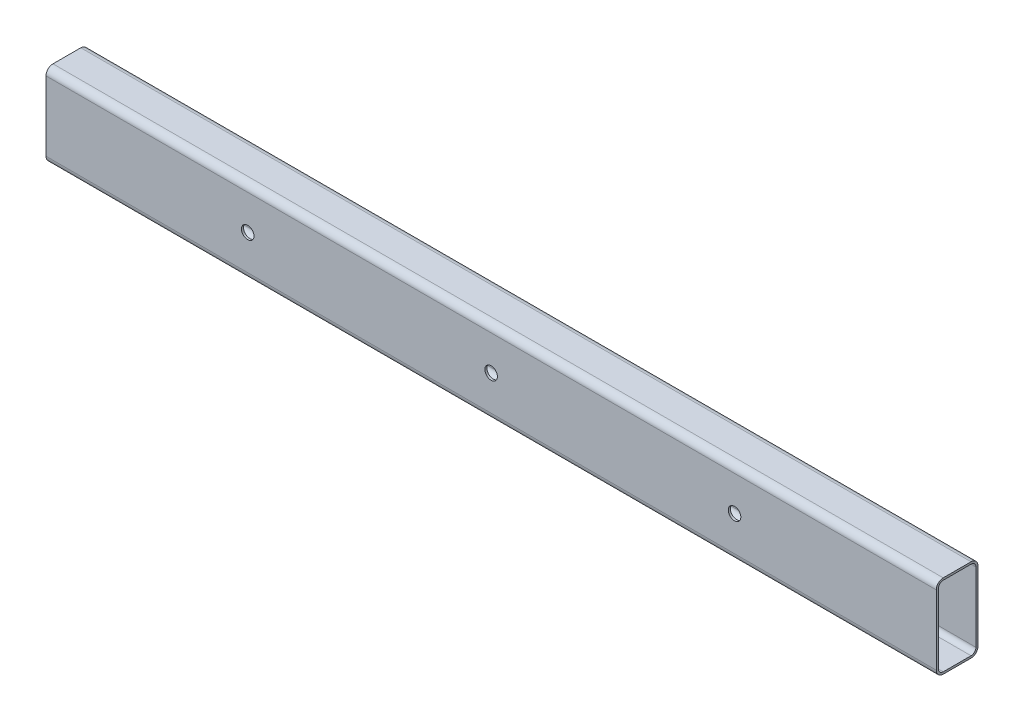
from build123d import *

# Parameters (mm, degrees)
EXTRUDE_THIN1_DEPTH      = 640
EXTRUDE_THIN1_DEPTH_BACK = 640
CUT_EXTRUDE1_DEPTH       = 644.506021728
CUT_EXTRUDE1_DEPTH_BACK  = 644.506021728
SKETCH2_R                = 9


with BuildPart() as part:
    # Sketch1 → Extrude-Thin1 (new, two sides: drawn at the far end of the back side and taken through both)
    with BuildSketch(Plane(origin=(0, 0, 0), x_dir=(0, 0, -1), z_dir=(1, 0, 0)).offset(-EXTRUDE_THIN1_DEPTH_BACK)):
        with BuildLine():
            Line((-30, 50), (-30, -50))
            ThreePointArc((-30, -50), (-27.071067812, -57.071067812), (-20, -60))
            Line((-20, -60), (20, -60))
            ThreePointArc((20, -60), (27.071067812, -57.071067812), (30, -50))
            Line((30, -50), (30, 50))
            ThreePointArc((30, 50), (27.071067812, 57.071067812), (20, 60))
            Line((20, 60), (-20, 60))
            ThreePointArc((-20, 60), (-27.071067812, 57.071067812), (-30, 50))
        make_face()
        with BuildLine():
            Line((-27, 50), (-27, -50))
            ThreePointArc((-27, -50), (-24.949747468, -54.949747468), (-20, -57))
            Line((-20, -57), (20, -57))
            ThreePointArc((20, -57), (24.949747468, -54.949747468), (27, -50))
            Line((27, -50), (27, 50))
            ThreePointArc((27, 50), (24.949747468, 54.949747468), (20, 57))
            Line((20, 57), (-20, 57))
            ThreePointArc((-20, 57), (-24.949747468, 54.949747468), (-27, 50))
        make_face(mode=Mode.SUBTRACT)
    extrude(amount=EXTRUDE_THIN1_DEPTH + EXTRUDE_THIN1_DEPTH_BACK)

    # Sketch2 → Cut-Extrude1 (cut, two sides: drawn at the far end of the back side and taken through both)
    with BuildSketch(Plane.XY.offset(-CUT_EXTRUDE1_DEPTH_BACK)):
        Circle(SKETCH2_R)
        with Locations((-350, 0)):
            Circle(SKETCH2_R)
        with Locations(Location((350, 0, 0), (0, 0, 180))):
            Circle(SKETCH2_R)
    extrude(amount=CUT_EXTRUDE1_DEPTH + CUT_EXTRUDE1_DEPTH_BACK, mode=Mode.SUBTRACT)


solid = part.part
